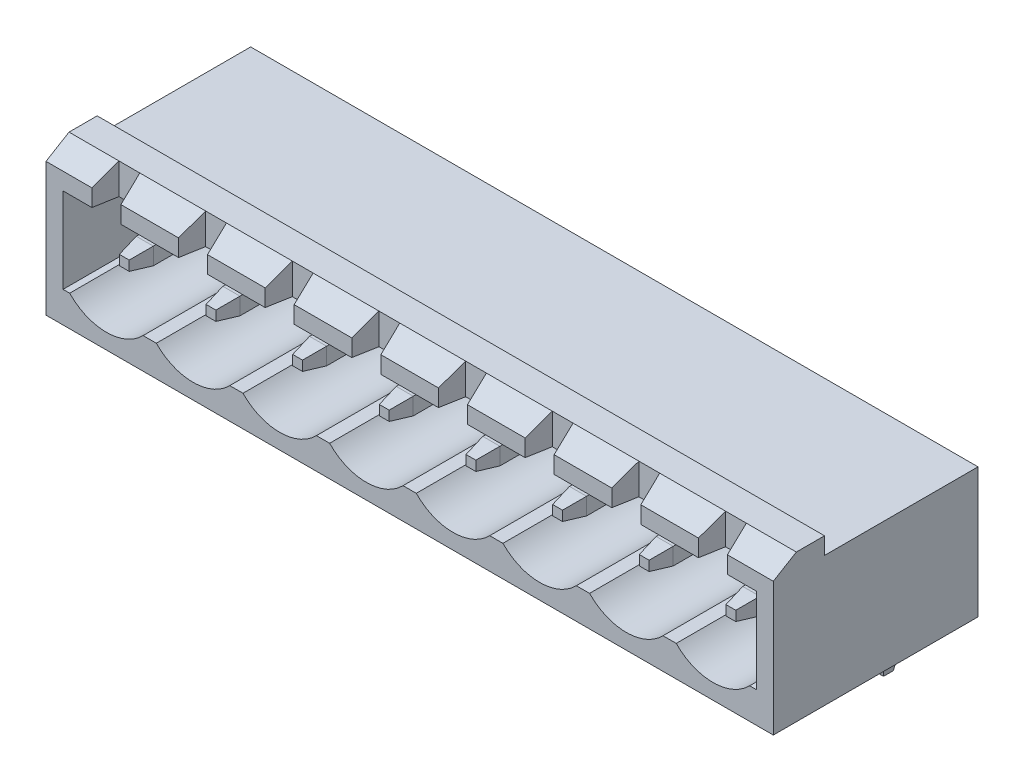
from build123d import *

# Parameters (mm, degrees)
SKETCH1_W           = 42.64
SKETCH1_H           = 7.62
BOSS_EXTRUDE1_DEPTH = 6
BOSS_EXTRUDE6_DEPTH = 42.64
CUT_EXTRUDE1_DEPTH  = 11.2
BOSS_EXTRUDE2_START = 2.5
BOSS_EXTRUDE2_DEPTH = 2.5
SKETCH4_R           = 1
BOSS_EXTRUDE3_DEPTH = 0.7
SKETCH5_W           = 1
SKETCH5_H           = 1
BOSS_EXTRUDE4_DEPTH = 5.75
SKETCH6_W           = 1
SKETCH6_H           = 1
BOSS_EXTRUDE5_DEPTH = 1.2
BOSS_EXTRUDE5_TAPER = 10
CUT_EXTRUDE2_START  = -1.81
CUT_EXTRUDE2_DEPTH  = 1.81
SKETCH10_W          = 1
SKETCH10_H          = 1
BOSS_EXTRUDE7_DEPTH = 2.3
SKETCH11_W          = 1
SKETCH11_H          = 1
BOSS_EXTRUDE8_DEPTH = 1.2
BOSS_EXTRUDE8_TAPER = 10
SKETCH12_W          = 2
SKETCH12_H          = 6.75
CUT_EXTRUDE3_DEPTH  = 0.5
LPATTERN1_COUNT     = 8
LPATTERN1_PITCH     = 5.08
LPATTERN2_COUNT     = 8
LPATTERN2_PITCH     = 5.08


with BuildPart() as part:
    # Sketch1 → Boss-Extrude1 (new, symmetric)
    with BuildSketch(Plane.XY):
        Rectangle(SKETCH1_W, SKETCH1_H)
    extrude(amount=BOSS_EXTRUDE1_DEPTH, both=True)

    # Sketch7 → Boss-Extrude6 (add)
    with BuildSketch(Plane(origin=(21.32, 0, 0), x_dir=(0, 0, -1), z_dir=(1, 0, 0))):
        Polygon((-6, 3.81), (-6, 4), (-4.65, 4.81), (-3, 4.81), (-3, 3.81), align=None)
    extrude(amount=-BOSS_EXTRUDE6_DEPTH)

    # Sketch2 → Cut-Extrude1 (cut)
    with BuildSketch(Plane.XY.offset(6)):
        with BuildLine():
            Line((15.627815064, -2), (15.24, -2))
            Line((15.24, -2), (15.24, 3))
            Line((15.24, 3), (20.32, 3))
            Line((20.32, 3), (20.32, -2))
            Line((20.32, -2), (19.932184936, -2))
            ThreePointArc((19.932184936, -2), (17.78, -2.91), (15.627815064, -2))
        make_face()
    cut_extrude1 = extrude(amount=-CUT_EXTRUDE1_DEPTH, mode=Mode.SUBTRACT)

    # Sketch3 → Boss-Extrude2 (add)
    with BuildSketch(Plane.XY.offset(-5.2).offset(BOSS_EXTRUDE2_START)):
        with BuildLine():
            Line((16.78, -1.028033989), (16.78, -2.738427125))
            ThreePointArc((16.78, -2.738427125), (17.78, -2.91), (18.78, -2.738427125))
            Line((18.78, -2.738427125), (18.78, -1.028033989))
            ThreePointArc((18.78, -1.028033989), (19.093299556, -0.634737384), (19.259019946, -0.16))
            Line((19.259019946, -0.16), (20.32, -0.16))
            Line((20.32, -0.16), (20.32, 0.34))
            Line((20.32, 0.34), (19.259019946, 0.34))
            ThreePointArc((19.259019946, 0.34), (18.840660172, 1.150660172), (18.03, 1.569019946))
            Line((18.03, 1.569019946), (18.03, 3))
            Line((18.03, 3), (17.53, 3))
            Line((17.53, 3), (17.53, 1.569019946))
            ThreePointArc((17.53, 1.569019946), (16.719339828, 1.150660172), (16.300980054, 0.34))
            Line((16.300980054, 0.34), (15.24, 0.34))
            Line((15.24, 0.34), (15.24, -0.16))
            Line((15.24, -0.16), (16.300980054, -0.16))
            ThreePointArc((16.300980054, -0.16), (16.466700444, -0.634737384), (16.78, -1.028033989))
        make_face()
    boss_extrude2 = extrude(amount=-BOSS_EXTRUDE2_DEPTH)

    # Sketch4 → Boss-Extrude3 (add)
    with BuildSketch(Plane.XY.offset(-2.7)):
        with Locations((17.78, 0.09)):
            Circle(SKETCH4_R)
    boss_extrude3 = extrude(amount=BOSS_EXTRUDE3_DEPTH)

    # Sketch9 → Cut-Extrude2 (cut)
    with BuildSketch(Plane(origin=(0, 4.81, 0), x_dir=(1, 0, 0), z_dir=(0, 1, 0)).offset(CUT_EXTRUDE2_START)):
        Polygon((16.93, -6), (17.17, -4.65), (18.39, -4.65), (18.63, -6), align=None)
    cut_extrude2 = extrude(amount=CUT_EXTRUDE2_DEPTH, mode=Mode.SUBTRACT)

    # Sketch12 → Cut-Extrude3 (cut)
    with BuildSketch(Plane(origin=(0, 0, -6), x_dir=(-1, 0, 0), z_dir=(0, 0, -1))):
        with Locations((-17.78, -0.435)):
            Rectangle(SKETCH12_W, SKETCH12_H)
    cut_extrude3 = extrude(amount=-CUT_EXTRUDE3_DEPTH, mode=Mode.SUBTRACT)

    # LPattern1: Cut-Extrude1, Boss-Extrude2, Boss-Extrude3, Cut-Extrude2, Cut-Extrude3 ×8
    with Locations(*[(-i * LPATTERN1_PITCH, 0, 0) for i in range(1, LPATTERN1_COUNT)]):
        add(cut_extrude1, mode=Mode.SUBTRACT)
        add(boss_extrude2)
        add(boss_extrude3)
        add(cut_extrude2, mode=Mode.SUBTRACT)
        add(cut_extrude3, mode=Mode.SUBTRACT)


with BuildPart() as body_2:
    # Sketch5 → Boss-Extrude4 (new body)
    with BuildSketch(Plane.XY.offset(-2)):
        with Locations((17.78, 0.09)):
            Rectangle(SKETCH5_W, SKETCH5_H)
    extrude(amount=BOSS_EXTRUDE4_DEPTH)

    # Sketch6 → Boss-Extrude5 (add)
    with BuildSketch(Plane.XY.offset(3.75)):
        with Locations((17.78, 0.09)):
            Rectangle(SKETCH6_W, SKETCH6_H)
    extrude(amount=BOSS_EXTRUDE5_DEPTH, taper=BOSS_EXTRUDE5_TAPER)


with BuildPart() as body_3:
    # Sketch10 → Boss-Extrude7 (new body)
    with BuildSketch(Plane.XZ.offset(3.81)):
        with Locations((17.78, -4)):
            Rectangle(SKETCH10_W, SKETCH10_H)
    extrude(amount=BOSS_EXTRUDE7_DEPTH)

    # Sketch11 → Boss-Extrude8 (add)
    with BuildSketch(Plane.XZ.offset(6.11)):
        with Locations((17.78, -4)):
            Rectangle(SKETCH11_W, SKETCH11_H)
    extrude(amount=BOSS_EXTRUDE8_DEPTH, taper=BOSS_EXTRUDE8_TAPER)


with BuildPart() as lpattern2_1:
    # LPattern2: pattern copy
    add(body_3.part.moved(Location(Vector(-1, 0, 0) * (1 * LPATTERN2_PITCH))))


with BuildPart() as lpattern2_2:
    # LPattern2: pattern copy
    add(body_3.part.moved(Location(Vector(-1, 0, 0) * (2 * LPATTERN2_PITCH))))


with BuildPart() as lpattern2_3:
    # LPattern2: pattern copy
    add(body_3.part.moved(Location(Vector(-1, 0, 0) * (3 * LPATTERN2_PITCH))))


with BuildPart() as lpattern2_4:
    # LPattern2: pattern copy
    add(body_3.part.moved(Location(Vector(-1, 0, 0) * (4 * LPATTERN2_PITCH))))


with BuildPart() as lpattern2_5:
    # LPattern2: pattern copy
    add(body_3.part.moved(Location(Vector(-1, 0, 0) * (5 * LPATTERN2_PITCH))))


with BuildPart() as lpattern2_6:
    # LPattern2: pattern copy
    add(body_3.part.moved(Location(Vector(-1, 0, 0) * (6 * LPATTERN2_PITCH))))


with BuildPart() as lpattern2_7:
    # LPattern2: pattern copy
    add(body_3.part.moved(Location(Vector(-1, 0, 0) * (7 * LPATTERN2_PITCH))))


with BuildPart() as lpattern2_8:
    # LPattern2: pattern copy
    add(body_2.part.moved(Location(Vector(-1, 0, 0) * (1 * LPATTERN2_PITCH))))


with BuildPart() as lpattern2_9:
    # LPattern2: pattern copy
    add(body_2.part.moved(Location(Vector(-1, 0, 0) * (2 * LPATTERN2_PITCH))))


with BuildPart() as lpattern2_10:
    # LPattern2: pattern copy
    add(body_2.part.moved(Location(Vector(-1, 0, 0) * (3 * LPATTERN2_PITCH))))


with BuildPart() as lpattern2_11:
    # LPattern2: pattern copy
    add(body_2.part.moved(Location(Vector(-1, 0, 0) * (4 * LPATTERN2_PITCH))))


with BuildPart() as lpattern2_12:
    # LPattern2: pattern copy
    add(body_2.part.moved(Location(Vector(-1, 0, 0) * (5 * LPATTERN2_PITCH))))


with BuildPart() as lpattern2_13:
    # LPattern2: pattern copy
    add(body_2.part.moved(Location(Vector(-1, 0, 0) * (6 * LPATTERN2_PITCH))))


with BuildPart() as lpattern2_14:
    # LPattern2: pattern copy
    add(body_2.part.moved(Location(Vector(-1, 0, 0) * (7 * LPATTERN2_PITCH))))


solid = Compound([part.part, body_2.part, body_3.part, lpattern2_1.part, lpattern2_2.part, lpattern2_3.part, lpattern2_4.part, lpattern2_5.part, lpattern2_6.part, lpattern2_7.part, lpattern2_8.part, lpattern2_9.part, lpattern2_10.part, lpattern2_11.part, lpattern2_12.part, lpattern2_13.part, lpattern2_14.part])
